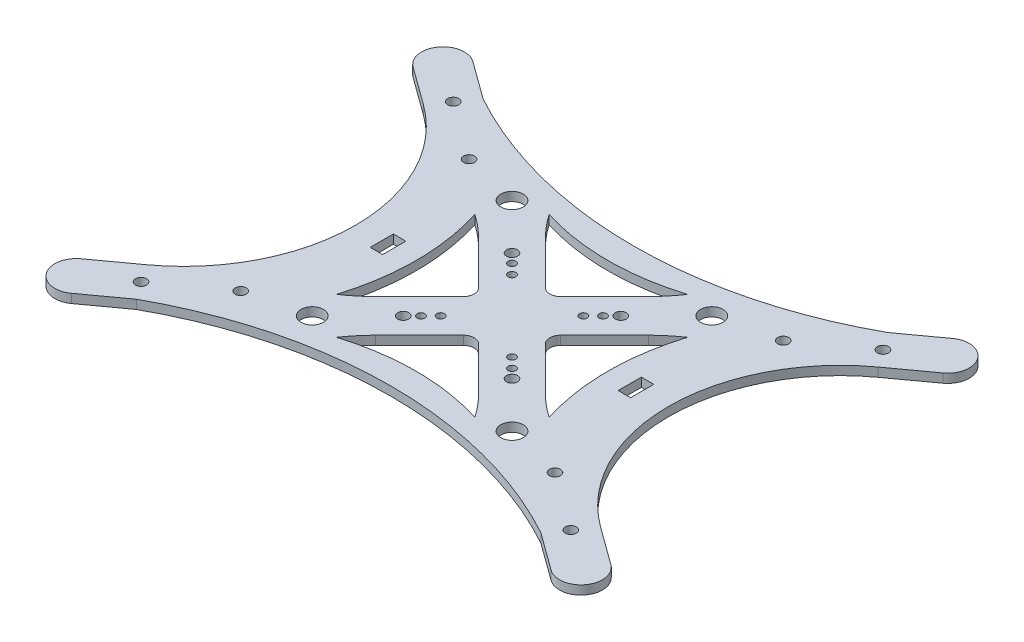
from build123d import *

# Parameters (mm, degrees)
SKETCH_1_R          = 1.075
SKETCH_1_R_2        = 1.55
SKETCH_1_R_3        = 3.15
SKETCH_1_R_4        = 3.150000003
EXTRUDE_1_DEPTH     = 2.5
CUT_EXTRUDE_1_REACH = 97.864
FILLET_1_R          = 3
CUT_EXTRUDE_2_REACH = 97.864
SKETCH_4_W          = 3.5
SKETCH_4_H          = 6.5


with BuildPart() as part:
    # 草图1 → 凸台-拉伸1 (new body)
    with BuildSketch(Plane(origin=(0, 0, 0), x_dir=(1, 0, 0), z_dir=(0, 1, 0))):
        with BuildLine():
            Line((74.268493783, -46.542811359), (63.739297222, -38.892902272))
            ThreePointArc((63.739297222, -38.892902272), (43.92237371, 0), (63.739297222, 38.892902272))
            Line((63.739297222, 38.892902272), (74.268493783, 46.542811359))
            ThreePointArc((74.268493783, 46.542811359), (75.595884236, 54.923624839), (67.215070756, 56.251015292))
            Line((67.215070756, 56.251015292), (56.685874194, 48.601106204))
            ThreePointArc((56.685874194, 48.601106204), (0, 33.998472353), (-56.685874194, 48.601106204))
            Line((-56.685874194, 48.601106204), (-67.215070756, 56.251015292))
            ThreePointArc((-67.215070756, 56.251015292), (-75.595884236, 54.923624839), (-74.268493783, 46.542811359))
            Line((-74.268493783, 46.542811359), (-63.739297222, 38.892902272))
            ThreePointArc((-63.739297222, 38.892902272), (-43.92237371, 0), (-63.739297222, -38.892902272))
            Line((-63.739297222, -38.892902272), (-74.268493783, -46.542811359))
            ThreePointArc((-74.268493783, -46.542811359), (-75.595884236, -54.923624839), (-67.215070756, -56.251015292))
            Line((-67.215070756, -56.251015292), (-56.685874194, -48.601106204))
            ThreePointArc((-56.685874194, -48.601106204), (0, -33.998472353), (56.685874194, -48.601106204))
            Line((56.685874194, -48.601106204), (67.215070756, -56.251015292))
            ThreePointArc((67.215070756, -56.251015292), (75.595884236, -54.923624839), (74.268493783, -46.542811359))
        make_face()
        with Locations(Location((10, 10, 0), (0, 0, 270))):
            Circle(SKETCH_1_R, mode=Mode.SUBTRACT)
        with Locations(Location((12.75, 12.75, 0), (0, 0, 270))):
            Circle(SKETCH_1_R, mode=Mode.SUBTRACT)
        with Locations(Location((15.25, 15.25, 0), (0, 0, 270))):
            Circle(SKETCH_1_R_2, mode=Mode.SUBTRACT)
        with Locations(Location((15.25, -15.25, 0), (0, 0, 90))):
            Circle(SKETCH_1_R_2, mode=Mode.SUBTRACT)
        with Locations(Location((12.75, -12.75, 0), (0, 0, 90))):
            Circle(SKETCH_1_R, mode=Mode.SUBTRACT)
        with Locations(Location((10, -10, 0), (0, 0, 90))):
            Circle(SKETCH_1_R, mode=Mode.SUBTRACT)
        with Locations(Location((28, -28, 0), (0, 0, 90))):
            Circle(SKETCH_1_R_3, mode=Mode.SUBTRACT)
        with Locations(Location((28, 28, 0), (0, 0, 270))):
            Circle(SKETCH_1_R_4, mode=Mode.SUBTRACT)
        with Locations(Location((44.044221455, -32, 0), (0, 0, 270))):
            Circle(SKETCH_1_R_2, mode=Mode.SUBTRACT)
        with Locations(Location((60.224561343, -43.755705046, 0), (0, 0, 270))):
            Circle(SKETCH_1_R_2, mode=Mode.SUBTRACT)
        with Locations(Location((60.224561343, 43.755705046, 0), (0, 0, 90))):
            Circle(SKETCH_1_R_2, mode=Mode.SUBTRACT)
        with Locations(Location((44.044221455, 32, 0), (0, 0, 90))):
            Circle(SKETCH_1_R_2, mode=Mode.SUBTRACT)
        with Locations(Location((-44.044221455, 32, 0), (0, 0, 270))):
            Circle(SKETCH_1_R_2, mode=Mode.SUBTRACT)
        with Locations(Location((-60.224561343, 43.755705046, 0), (0, 0, 270))):
            Circle(SKETCH_1_R_2, mode=Mode.SUBTRACT)
        with Locations(Location((-60.224561343, -43.755705046, 0), (0, 0, 90))):
            Circle(SKETCH_1_R_2, mode=Mode.SUBTRACT)
        with Locations(Location((-44.044221455, -32, 0), (0, 0, 90))):
            Circle(SKETCH_1_R_2, mode=Mode.SUBTRACT)
        with Locations(Location((-28, 28, 0), (0, 0, 90))):
            Circle(SKETCH_1_R_4, mode=Mode.SUBTRACT)
        with Locations(Location((-28, -28, 0), (0, 0, 270))):
            Circle(SKETCH_1_R_3, mode=Mode.SUBTRACT)
        with Locations(Location((-10, -10, 0), (0, 0, 270))):
            Circle(SKETCH_1_R, mode=Mode.SUBTRACT)
        with Locations(Location((-12.75, -12.75, 0), (0, 0, 270))):
            Circle(SKETCH_1_R, mode=Mode.SUBTRACT)
        with Locations(Location((-15.25, -15.25, 0), (0, 0, 270))):
            Circle(SKETCH_1_R_2, mode=Mode.SUBTRACT)
        with Locations(Location((-15.25, 15.25, 0), (0, 0, 90))):
            Circle(SKETCH_1_R_2, mode=Mode.SUBTRACT)
        with Locations(Location((-12.75, 12.75, 0), (0, 0, 90))):
            Circle(SKETCH_1_R, mode=Mode.SUBTRACT)
        with Locations(Location((-10, 10, 0), (0, 0, 90))):
            Circle(SKETCH_1_R, mode=Mode.SUBTRACT)
    extrude(amount=EXTRUDE_1_DEPTH)

    # 草图2 → 切除-拉伸1 (cut, up to next)
    with BuildSketch(Plane(origin=(0, 2.5, 0), x_dir=(1, 0, 0), z_dir=(0, 1, 0)), mode=Mode.PRIVATE) as cut_extrude_1_sk1:
        with BuildLine():
            Line((-23.801448899, 14.429581723), (-9.371867176, 0))
            Line((-9.371867176, 0), (-23.801448899, -14.429581723))
            ThreePointArc((-23.801448899, -14.429581723), (-26.692624222, -17.058284994), (-29.820182402, -19.400795498))
            ThreePointArc((-29.820182402, -19.400795498), (-26.863678166, 0), (-29.820182402, 19.400795498))
            ThreePointArc((-29.820182402, 19.400795498), (-26.692624222, 17.058284994), (-23.801448899, 14.429581723))
        make_face()
    cut_extrude_1_tool1 = extrude(cut_extrude_1_sk1.sketch, amount=-CUT_EXTRUDE_1_REACH, mode=Mode.PRIVATE) & part.part
    # 草图2 → 切除-拉伸1 (cut, up to next)
    with BuildSketch(Plane(origin=(0, 2.5, 0), x_dir=(1, 0, 0), z_dir=(0, 1, 0)), mode=Mode.PRIVATE) as cut_extrude_1_sk2:
        with BuildLine():
            Line((14.429581723, 23.801448899), (0, 9.371867176))
            Line((0, 9.371867176), (-14.429581723, 23.801448899))
            ThreePointArc((-14.429581723, 23.801448899), (-17.058284994, 26.692624222), (-19.400795498, 29.820182402))
            ThreePointArc((-19.400795498, 29.820182402), (0, 26.863678166), (19.400795498, 29.820182402))
            ThreePointArc((19.400795498, 29.820182402), (17.058284994, 26.692624222), (14.429581723, 23.801448899))
        make_face()
    cut_extrude_1_tool2 = extrude(cut_extrude_1_sk2.sketch, amount=-CUT_EXTRUDE_1_REACH, mode=Mode.PRIVATE) & part.part
    # 草图2 → 切除-拉伸1 (cut, up to next)
    with BuildSketch(Plane(origin=(0, 2.5, 0), x_dir=(1, 0, 0), z_dir=(0, 1, 0)), mode=Mode.PRIVATE) as cut_extrude_1_sk3:
        with BuildLine():
            Line((23.801448899, -14.429581723), (9.371867176, 0))
            Line((9.371867176, 0), (23.801448899, 14.429581723))
            ThreePointArc((23.801448899, 14.429581723), (26.692624222, 17.058284994), (29.820182402, 19.400795498))
            ThreePointArc((29.820182402, 19.400795498), (26.863678166, 0), (29.820182402, -19.400795498))
            ThreePointArc((29.820182402, -19.400795498), (26.692624222, -17.058284994), (23.801448899, -14.429581723))
        make_face()
    cut_extrude_1_tool3 = extrude(cut_extrude_1_sk3.sketch, amount=-CUT_EXTRUDE_1_REACH, mode=Mode.PRIVATE) & part.part
    # 草图2 → 切除-拉伸1 (cut, up to next)
    with BuildSketch(Plane(origin=(0, 2.5, 0), x_dir=(1, 0, 0), z_dir=(0, 1, 0)), mode=Mode.PRIVATE) as cut_extrude_1_sk4:
        with BuildLine():
            Line((-14.429581723, -23.801448899), (0, -9.371867176))
            Line((0, -9.371867176), (14.429581723, -23.801448899))
            ThreePointArc((14.429581723, -23.801448899), (17.058284994, -26.692624222), (19.400795498, -29.820182402))
            ThreePointArc((19.400795498, -29.820182402), (0, -26.863678166), (-19.400795498, -29.820182402))
            ThreePointArc((-19.400795498, -29.820182402), (-17.058284994, -26.692624222), (-14.429581723, -23.801448899))
        make_face()
    cut_extrude_1_tool4 = extrude(cut_extrude_1_sk4.sketch, amount=-CUT_EXTRUDE_1_REACH, mode=Mode.PRIVATE) & part.part
    add(cut_extrude_1_tool1.solids().sort_by_distance((-21.651527, 2.5, 0))[0], mode=Mode.SUBTRACT)
    add(cut_extrude_1_tool2.solids().sort_by_distance((0, 2.5, -21.651527))[0], mode=Mode.SUBTRACT)
    add(cut_extrude_1_tool3.solids().sort_by_distance((21.651527, 2.5, 0))[0], mode=Mode.SUBTRACT)
    add(cut_extrude_1_tool4.solids().sort_by_distance((0, 2.5, 21.651527))[0], mode=Mode.SUBTRACT)

    # 圆角1
    fillet_1_edges = [part.edges().sort_by_distance(p)[0] for p in [
        (9.371867176, 1.25, 0),
        (0, 1.25, -9.371867176),
        (0, 1.25, 9.371867176),
        (-9.371867176, 1.25, 0),
    ]]
    fillet(fillet_1_edges, radius=FILLET_1_R)

    # 草图4 → 切除-拉伸2 (cut, up to next)
    with BuildSketch(Plane(origin=(0, 2.5, 0), x_dir=(1, 0, 0), z_dir=(0, 1, 0)), mode=Mode.PRIVATE) as cut_extrude_2_sk1:
        with Locations((34.75, 0)):
            Rectangle(SKETCH_4_W, SKETCH_4_H)
    cut_extrude_2_tool1 = extrude(cut_extrude_2_sk1.sketch, amount=-CUT_EXTRUDE_2_REACH, mode=Mode.PRIVATE) & part.part
    # 草图4 → 切除-拉伸2 (cut, up to next)
    with BuildSketch(Plane(origin=(0, 2.5, 0), x_dir=(1, 0, 0), z_dir=(0, 1, 0)), mode=Mode.PRIVATE) as cut_extrude_2_sk2:
        with Locations((-34.75, 0)):
            Rectangle(SKETCH_4_W, SKETCH_4_H)
    cut_extrude_2_tool2 = extrude(cut_extrude_2_sk2.sketch, amount=-CUT_EXTRUDE_2_REACH, mode=Mode.PRIVATE) & part.part
    add(cut_extrude_2_tool1.solids().sort_by_distance((34.75, 2.5, 0))[0], mode=Mode.SUBTRACT)
    add(cut_extrude_2_tool2.solids().sort_by_distance((-34.75, 2.5, 0))[0], mode=Mode.SUBTRACT)


solid = part.part
